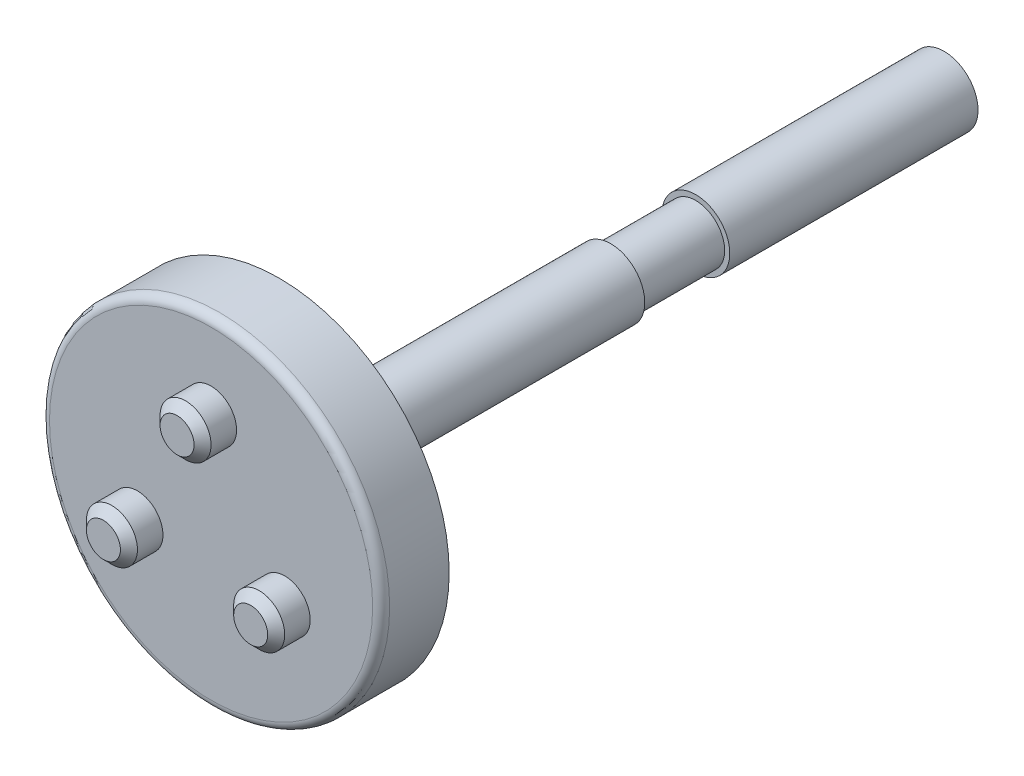
from build123d import *

# Parameters (mm, degrees)
SKETCH1_R           = 100
BOSS_EXTRUDE1_DEPTH = 40
SKETCH2_R           = 15
BOSS_EXTRUDE2_DEPTH = 20
SKETCH3_R           = 20
BOSS_EXTRUDE3_DEPTH = 495
CUT_EXTRUDE1_START  = -250
SKETCH4_OUTSIDE_W   = 326.584
SKETCH4_OUTSIDE_H   = 326.584
SKETCH4_OUTSIDE_R   = 17
CUT_EXTRUDE1_DEPTH  = 50
CHAMFER1_SIZE       = 5
FILLET1_R           = 5
CUT_EXTRUDE2_START  = -104.02
SKETCH5_R           = 20
CUT_EXTRUDE2_DEPTH  = 104.02


with BuildPart() as part:
    # Sketch1 → Boss-Extrude1 (new body)
    with BuildSketch(Plane.XY):
        Circle(SKETCH1_R)
    extrude(amount=BOSS_EXTRUDE1_DEPTH)

    # Sketch2 → Boss-Extrude2 (add)
    with BuildSketch(Plane.XY.offset(40)):
        with Locations((0, 50)):
            Circle(SKETCH2_R)
        with Locations((43.301270189, -25)):
            Circle(SKETCH2_R)
        with Locations((-43.301270189, -25)):
            Circle(SKETCH2_R)
    extrude(amount=BOSS_EXTRUDE2_DEPTH)

    # Sketch3 → Boss-Extrude3 (add)
    with BuildSketch(Plane(origin=(0, 0, 0), x_dir=(-1, 0, 0), z_dir=(0, 0, -1))):
        Circle(SKETCH3_R)
    extrude(amount=BOSS_EXTRUDE3_DEPTH)

    # Sketch4 outside → Cut-Extrude1 (cut)
    with BuildSketch(Plane(origin=(0, 0, -495), x_dir=(-1, 0, 0), z_dir=(0, 0, -1)).offset(CUT_EXTRUDE1_START)):
        Rectangle(SKETCH4_OUTSIDE_W, SKETCH4_OUTSIDE_H)
        Circle(SKETCH4_OUTSIDE_R, mode=Mode.SUBTRACT)
    extrude(amount=-CUT_EXTRUDE1_DEPTH, mode=Mode.SUBTRACT)

    # Chamfer1
    chamfer1_edges = [part.edges().sort_by_distance(p)[0] for p in [
        (-58.301270189, -25, 60),
        (-15, 50, 60),
        (28.301270189, -25, 60),
    ]]
    chamfer(chamfer1_edges, length=CHAMFER1_SIZE)

    # Fillet1
    fillet1_edges = [part.edges().sort_by_distance(p)[0] for p in [
        (-100, 0, 40),
    ]]
    fillet(fillet1_edges, radius=FILLET1_R)

    # Sketch5 → Cut-Extrude2 (cut)
    with BuildSketch(Plane(origin=(0, 0, -495), x_dir=(-1, 0, 0), z_dir=(0, 0, -1)).offset(CUT_EXTRUDE2_START)):
        Circle(SKETCH5_R)
    extrude(amount=CUT_EXTRUDE2_DEPTH, mode=Mode.SUBTRACT)


solid = part.part
